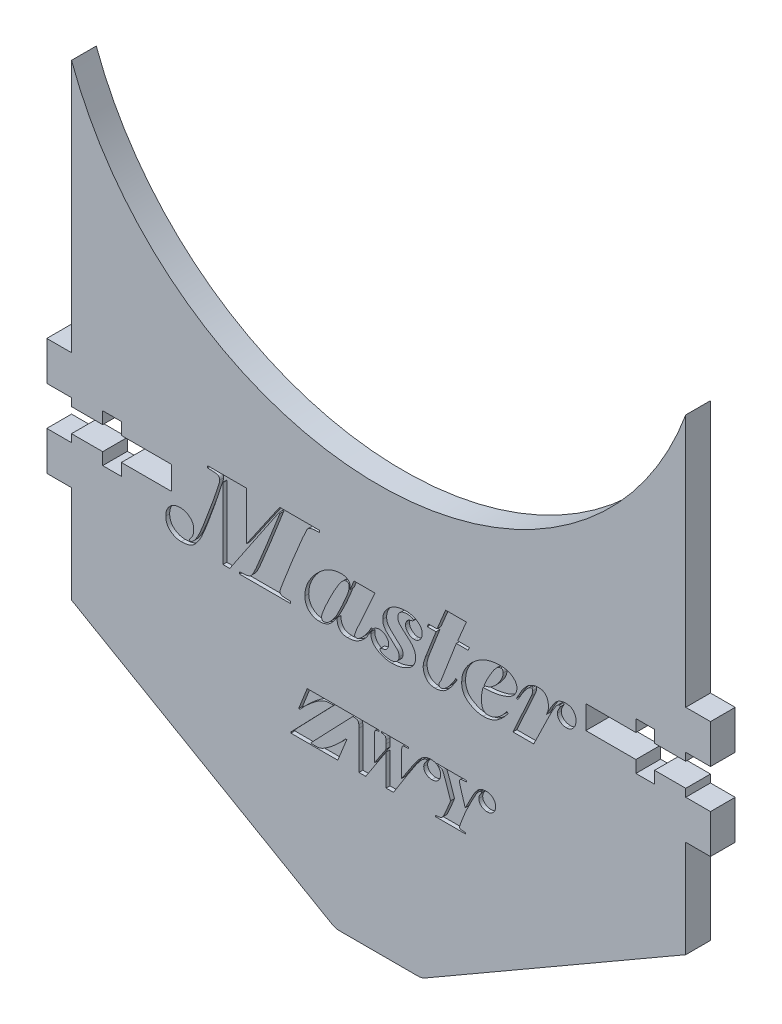
from build123d import *

# Parameters (mm, degrees)
BOSS_EXTRUDE1_DEPTH = 3.175
SKETCH2_W           = 3.175
SKETCH2_H           = 5
BOSS_EXTRUDE2_DEPTH = 3.175
CUT_EXTRUDE1_DEPTH  = 59.51485901
CUT_EXTRUDE2_DEPTH  = 0.5


with BuildPart() as part:
    # Sketch1 → Boss-Extrude1 (new body)
    with BuildSketch(Plane.XY):
        with BuildLine():
            Line((39.415, -20), (39.415, 40))
            ThreePointArc((39.415, 40), (0, 12.507162886), (-39.415, 40))
            Line((-39.415, 40), (-39.415, -20))
            Line((-39.415, -20), (-6, -39.292159245))
            ThreePointArc((-6, -39.292159245), (-5.51763809, -39.49196009), (-5, -39.560108437))
            Line((-5, -39.560108437), (5, -39.560108437))
            ThreePointArc((5, -39.560108437), (5.51763809, -39.49196009), (6, -39.292159245))
            Line((6, -39.292159245), (39.415, -20))
        make_face()
    extrude(amount=BOSS_EXTRUDE1_DEPTH)

    # Sketch2 → Boss-Extrude2 (add)
    with BuildSketch(Plane.XY.offset(3.175)):
        with Locations((41.0025, -5)):
            Rectangle(SKETCH2_W, SKETCH2_H)
        with Locations((41.0025, 5)):
            Rectangle(SKETCH2_W, SKETCH2_H)
        with Locations((-41.0025, 5)):
            Rectangle(SKETCH2_W, SKETCH2_H)
        with Locations((-41.0025, -5)):
            Rectangle(SKETCH2_W, SKETCH2_H)
    extrude(amount=-BOSS_EXTRUDE2_DEPTH)

    # Sketch3 → Cut-Extrude1 (cut, through all)
    with BuildSketch(Plane.XY.offset(3.175)):
        Polygon((39.415, 1.5), (35.415, 1.5), (35.415, 3.05), (33.015, 3.05), (33.015, 1.5), (26.59, 1.5), (26.59, -1.5), (33.015, -1.5), (33.015, -3.05), (35.415, -3.05), (35.415, -1.5), (39.415, -1.5), align=None)
        Polygon((-39.415, -1.5), (-35.415, -1.5), (-35.415, -3.05), (-33.015, -3.05), (-33.015, -1.5), (-26.59, -1.5), (-26.59, 1.5), (-33.015, 1.5), (-33.015, 3.05), (-35.415, 3.05), (-35.415, 1.5), (-39.415, 1.5), align=None)
    extrude(amount=-CUT_EXTRUDE1_DEPTH, mode=Mode.SUBTRACT)

    # Sketch4 → Cut-Extrude2 (cut)
    # profile 1 of 9: a face of its own
    with BuildSketch(Plane.XY.offset(3.175)):
        with BuildLine():
            add(Edge.make_bspline(
                [(-22.083054723, -3.089165405), (-22.117141833, -3.178244797), (-22.183169421, -3.35079382), (-22.28218976, -3.599967197), (-22.376683818, -3.831584406), (-22.46876402, -4.04511084), (-22.552156901, -4.242598925), (-22.634229557, -4.421527445), (-22.7105868, -4.582470158), (-22.807148017, -4.777327178), (-22.939887474, -5.011501886), (-23.125062253, -5.29156722), (-23.342332173, -5.577032049), (-23.540803582, -5.820170358), (-23.726332408, -6.004899245), (-23.890683112, -6.127342364), (-24.078271275, -6.227023973), (-24.285775958, -6.310514245), (-24.514373621, -6.375844997), (-24.764308042, -6.419704029), (-25.035333741, -6.448061897), (-25.223140992, -6.451629853), (-25.320792065, -6.453485025)],
                knots=[0, 0, 0, 0, 1.130253329, 2.189329135, 3.17735093, 4.09447093, 4.944908437, 5.717576898, 6.426986212, 7.055897021, 8.294352839, 9.613983634, 11.031209606, 12.54471876, 13.329263969, 14.127728774, 14.963250249, 15.839528184, 16.774249319, 17.774916539, 18.843059645, 20, 20, 20, 20], degree=3))
            add(Edge.make_bspline(
                [(-25.320792065, -6.453485025), (-25.388770052, -6.452021159), (-25.522514766, -6.449141046), (-25.719049601, -6.42473497), (-25.907748059, -6.38547897), (-26.089077295, -6.329581893), (-26.262394982, -6.258579351), (-26.429171416, -6.172846007), (-26.586943555, -6.069424139), (-26.736916743, -5.952042506), (-26.872056518, -5.820102517), (-26.992689943, -5.678720554), (-27.094789944, -5.525864124), (-27.174357461, -5.360381648), (-27.241488452, -5.187784455), (-27.286884916, -5.003731529), (-27.311949438, -4.809273663), (-27.316232115, -4.676129724), (-27.318418647, -4.608152747)],
                knots=[0, 0, 0, 0, 1.071060617, 2.107280627, 3.116046219, 4.105358694, 5.093306033, 6.064610982, 7.056049313, 8.062189232, 9.061545745, 10.02744445, 10.987119263, 11.94904156, 12.915889936, 13.901265703, 14.928485854, 16, 16, 16, 16], degree=3))
            add(Edge.make_bspline(
                [(-27.318418647, -4.608152747), (-27.317224387, -4.542115243), (-27.31488592, -4.412808045), (-27.286948526, -4.223875436), (-27.24890216, -4.042550822), (-27.19109857, -3.869396478), (-27.115354004, -3.705820493), (-27.026041784, -3.549273759), (-26.91883437, -3.403034678), (-26.796164364, -3.267380684), (-26.662566078, -3.142572645), (-26.517597, -3.033946668), (-26.365163275, -2.940081369), (-26.203930141, -2.864495509), (-26.033944617, -2.806883401), (-25.855681001, -2.765981411), (-25.669058022, -2.738923933), (-25.541748206, -2.736408886), (-25.477042065, -2.735130595)],
                knots=[0, 0, 0, 0, 1.077914775, 2.110651251, 3.114162268, 4.10188549, 5.085076634, 6.054963139, 7.041628779, 8.040737395, 9.03914912, 10.023578354, 10.995197602, 11.958844516, 12.926156071, 13.921542299, 14.943608732, 16, 16, 16, 16], degree=3))
            add(Edge.make_bspline(
                [(-25.477042065, -2.735130595), (-25.419595275, -2.735851224), (-25.306242288, -2.737273155), (-25.139175314, -2.761232445), (-24.976758059, -2.793590043), (-24.819881993, -2.841522943), (-24.668817679, -2.902867834), (-24.52448494, -2.978781465), (-24.384130354, -3.066274253), (-24.251898015, -3.16783735), (-24.129506149, -3.279763527), (-24.02151869, -3.400237419), (-23.932538536, -3.530873082), (-23.855611987, -3.66746259), (-23.798665226, -3.81416201), (-23.759722119, -3.96909225), (-23.732393566, -4.130530634), (-23.729891022, -4.241475269), (-23.728624343, -4.297630595)],
                knots=[0, 0, 0, 0, 1.054047744, 2.079828284, 3.093821156, 4.093544032, 5.087383538, 6.083874859, 7.084989954, 8.121505244, 9.14126522, 10.12770117, 11.084945916, 12.038738356, 13.001100257, 13.964375792, 14.969655976, 16, 16, 16, 16], degree=3))
            add(Edge.make_bspline(
                [(-23.728624343, -4.297630595), (-23.730475295, -4.386115783), (-23.733918848, -4.550735729), (-23.769675123, -4.781334114), (-23.828669673, -4.982089528), (-23.905753597, -5.163225925), (-24.008485183, -5.329324338), (-24.114386666, -5.449437919), (-24.200639521, -5.5363159), (-24.242459591, -5.600250382), (-24.275716149, -5.656002598), (-24.278961907, -5.694303346), (-24.280443964, -5.711791987)],
                knots=[0, 0, 0, 0, 1.698291013, 3.159540941, 4.465663762, 5.707551953, 6.930186915, 8.196362992, 8.778912473, 9.270581738, 9.66693773, 10, 10, 10, 10], degree=3))
            add(Edge.make_bspline(
                [(-24.280443964, -5.711791987), (-24.279382151, -5.728100747), (-24.277412245, -5.758357253), (-24.249954883, -5.796357905), (-24.206688915, -5.819522821), (-24.172657702, -5.820199752), (-24.153861685, -5.820573633)],
                knots=[0, 0, 0, 0, 1.012471401, 1.878367653, 2.828186478, 4, 4, 4, 4], degree=3))
            add(Edge.make_bspline(
                [(-24.153861685, -5.820573633), (-24.13590597, -5.817916341), (-24.094757231, -5.811826681), (-24.028730968, -5.784261091), (-23.954595186, -5.736449486), (-23.866146669, -5.675562966), (-23.768947537, -5.5918678), (-23.667195535, -5.481934516), (-23.558114294, -5.348111423), (-23.442272679, -5.190586138), (-23.321649636, -5.009109242), (-23.201497023, -4.802749151), (-23.081089962, -4.572941365), (-22.980933688, -4.362159443), (-22.895231235, -4.16872856), (-22.818280808, -3.992506423), (-22.733774647, -3.78536157), (-22.637299579, -3.550481794), (-22.526687638, -3.287383655), (-22.412326941, -2.992530053), (-22.282379382, -2.670297198), (-21.999877557, -1.949616777), (-21.571214589, -0.825251734), (-21.172921575, 0.315202588), (-20.923482076, 1.06588977), (-20.810982251, 1.394731666), (-20.717599163, 1.682912946), (-20.63567077, 1.92767722), (-20.570339464, 2.130927644), (-20.518629218, 2.291515253), (-20.483121489, 2.411066457), (-20.45358554, 2.511340462), (-20.434526493, 2.604205636), (-20.415460655, 2.696867044), (-20.40519758, 2.776908883), (-20.402924723, 2.825898939), (-20.401883837, 2.848334595)],
                knots=[0, 0, 0, 0, 0.192575675, 0.441321659, 0.752836899, 1.130313472, 1.582922549, 2.113752192, 2.72167908, 3.418812986, 4.192969055, 5.038546036, 5.957702433, 6.952117726, 7.520359453, 8.208260331, 8.997517169, 9.900068989, 10.909432829, 12.033339314, 13.264029703, 14.605439118, 20.267570344, 26.063238804, 27.453779967, 28.682430436, 29.760273926, 30.676214043, 31.428066217, 32.031363842, 32.470683115, 32.754868888, 33.142819525, 33.478428447, 33.761139272, 34, 34, 34, 34], degree=3))
            add(Edge.make_bspline(
                [(-20.401883837, 2.848334595), (-20.405134454, 2.90301829), (-20.411221831, 3.005423553), (-20.471330842, 3.145102924), (-20.574364559, 3.251931139), (-20.692005688, 3.30709937), (-20.804961003, 3.339816824), (-20.912445508, 3.36019694), (-21.03947106, 3.381199987), (-21.187015123, 3.392848375), (-21.354431899, 3.40504182), (-21.540999912, 3.415676886), (-21.748134837, 3.418175115), (-21.892524023, 3.419327569), (-21.968339533, 3.419932696)],
                knots=[0, 0, 0, 0, 1.052042775, 1.970143324, 2.870854876, 3.8561861, 4.440491552, 5.142328593, 5.967286194, 6.926595273, 7.999097623, 9.210638798, 10.535369249, 12, 12, 12, 12], degree=3))
            Line((-21.968339533, 3.419932696), (-21.968339533, 3.673097253))
            Line((-21.968339533, 3.673097253), (-16.938671812, 3.673097253))
            Line((-16.938671812, 3.673097253), (-16.938671812, -2.491855278))
            Line((-16.938671812, -2.491855278), (-12.700143331, 3.673097253))
            Line((-12.700143331, 3.673097253), (-7.601250926, 3.673097253))
            Line((-7.601250926, 3.673097253), (-7.601250926, 3.419932696))
            Line((-7.601250926, 3.419932696), (-8.313276242, 3.378397886))
            add(Edge.make_bspline(
                [(-8.313276242, 3.378397886), (-8.365435493, 3.373114786), (-8.465590487, 3.362970299), (-8.608779557, 3.337971268), (-8.737576529, 3.301987095), (-8.853745176, 3.259468142), (-8.954852452, 3.205385019), (-9.043838473, 3.144942318), (-9.115560036, 3.071688534), (-9.179992002, 2.986243364), (-9.239961179, 2.872904906), (-9.316269069, 2.726806654), (-9.403403277, 2.535303906), (-9.511069216, 2.303584559), (-9.630094644, 2.027333806), (-9.770204677, 1.711514571), (-9.92140916, 1.350775549), (-10.085228796, 0.957704257), (-10.253551722, 0.550736691), (-10.419362673, 0.150689316), (-10.577567948, -0.233954377), (-10.730273448, -0.602323276), (-10.876582976, -0.955448837), (-11.014623084, -1.293171163), (-11.145616359, -1.614983878), (-11.309598821, -2.017346235), (-11.500912987, -2.497126352), (-11.722170563, -3.046431921), (-11.923048385, -3.566565245), (-12.079596099, -3.97834864), (-12.195405389, -4.285002441), (-12.272269242, -4.490798371), (-12.342171387, -4.675568963), (-12.39986312, -4.840815618), (-12.455835059, -4.983125039), (-12.497000215, -5.107731261), (-12.535885846, -5.209645009), (-12.571278446, -5.314568033), (-12.604778207, -5.419284201), (-12.635121139, -5.523238719), (-12.654950533, -5.601652335), (-12.658980366, -5.646464649), (-12.660586369, -5.664323633)],
                knots=[0, 0, 0, 0, 0.609719282, 1.170768945, 1.687971488, 2.163657319, 2.606169063, 3.018909416, 3.409318741, 3.79273691, 4.259752201, 4.897656796, 5.710684151, 6.705800193, 7.869826431, 9.209048519, 10.724457597, 12.419165901, 14.162247475, 15.846932979, 17.45612035, 18.99982494, 20.485133676, 21.902038904, 23.243454641, 24.526479772, 26.955790176, 29.251245295, 31.414389885, 33.441000648, 34.375314494, 35.227055323, 35.996226954, 36.673000752, 37.26266748, 37.774383521, 38.198922844, 38.531149764, 39.062263512, 39.477277151, 39.791680049, 40, 40, 40, 40], degree=3))
            add(Edge.make_bspline(
                [(-12.660586369, -5.664323633), (-12.657222325, -5.70666254), (-12.650882011, -5.78645996), (-12.589592536, -5.89359474), (-12.487737326, -5.968196491), (-12.34671178, -6.014627178), (-12.162307681, -6.040278661), (-11.926434987, -6.058244339), (-11.6349091, -6.072814016), (-11.421816409, -6.073412331), (-11.305760419, -6.07373819)],
                knots=[0, 0, 0, 0, 0.649345372, 1.22384086, 1.840780064, 2.555677005, 3.494523509, 4.710168862, 6.208269811, 8, 8, 8, 8], degree=3))
            Line((-11.305760419, -6.07373819), (-11.305760419, -6.326902747))
            Line((-11.305760419, -6.326902747), (-17.824747761, -6.326902747))
            Line((-17.824747761, -6.326902747), (-17.824747761, -6.07373819))
            Line((-17.824747761, -6.07373819), (-17.073165483, -6.018358443))
            add(Edge.make_bspline(
                [(-17.073165483, -6.018358443), (-16.994222334, -6.007642286), (-16.84431899, -5.987293619), (-16.638397026, -5.920282806), (-16.465676124, -5.826057535), (-16.344205467, -5.723482824), (-16.264213215, -5.618292584), (-16.195815181, -5.522715868), (-16.123589542, -5.406232829), (-16.047148851, -5.269924986), (-15.965494962, -5.114206557), (-15.879335212, -4.939341608), (-15.787814671, -4.744096401), (-15.65582942, -4.448764991), (-15.479068347, -4.043217744), (-15.257788709, -3.515105111), (-15.018521717, -2.936492506), (-14.764286786, -2.307415851), (-14.497065389, -1.632000759), (-14.212081732, -0.917930798), (-13.914880901, -0.164972224), (-13.662948361, 0.480549148), (-13.458413843, 0.995929992), (-13.317647703, 1.362334517), (-13.182231164, 1.699663018), (-13.059162818, 2.010674061), (-12.949278276, 2.295425181), (-12.847784011, 2.552960663), (-12.757398249, 2.783945049), (-12.699557544, 2.928796148), (-12.672453457, 2.996673203)],
                knots=[0, 0, 0, 0, 0.65053556, 1.235287143, 1.758915764, 2.251867672, 2.520449317, 2.83756191, 3.213006897, 3.640298547, 4.115356038, 4.650595122, 5.234227324, 5.878500359, 7.295707455, 8.85166571, 10.56064525, 12.41569243, 14.399872011, 16.500178696, 18.702616275, 21.019204905, 22.166478535, 23.236698744, 24.228788535, 25.138795108, 25.971746855, 26.724588927, 27.402343865, 28, 28, 28, 28], degree=3))
            Line((-12.672453457, 2.996673203), (-12.781235103, 3.05205295))
            Line((-12.781235103, 3.05205295), (-19.106393331, -6.326902747))
            Line((-19.106393331, -6.326902747), (-19.976646495, -6.326902747))
            Line((-19.976646495, -6.326902747), (-19.976646495, 2.78108776))
            Line((-19.976646495, 2.78108776), (-20.030048394, 2.78108776))
            add(Edge.make_bspline(
                [(-20.030048394, 2.78108776), (-20.105264224, 2.552335546), (-20.251137438, 2.108694622), (-20.462034675, 1.464117477), (-20.661689325, 0.862149594), (-20.822199409, 0.388890597), (-20.939226726, 0.033421175), (-21.023856381, -0.210423264), (-21.099650952, -0.43921213), (-21.172697545, -0.650904488), (-21.243128408, -0.84539283), (-21.305606429, -1.024345947), (-21.362953035, -1.187430286), (-21.418587456, -1.339640213), (-21.476377117, -1.493752829), (-21.539397882, -1.66197212), (-21.611887874, -1.849796307), (-21.68636217, -2.059883268), (-21.778262394, -2.286795877), (-21.872000173, -2.536719351), (-21.97441219, -2.806531426), (-22.046065082, -2.992936707), (-22.083054723, -3.089165405)],
                knots=[0, 0, 0, 0, 2.322821778, 4.504869202, 6.542096527, 8.440562444, 9.325438639, 10.152015468, 10.930306902, 11.650319291, 12.3121151, 12.925577606, 13.478716634, 13.979673956, 14.488799598, 15.066403991, 15.712490578, 16.430787678, 17.216140408, 18.073625888, 19.005540664, 20, 20, 20, 20], degree=3))
        make_face()
    # profile 2 of 9: a face of its own
    with BuildSketch(Plane.XY.offset(3.175)):
        with BuildLine():
            Line((-0.475064217, 0.255375734), (-2.840570546, -5.005700215))
            add(Edge.make_bspline(
                [(-2.840570546, -5.005700215), (-2.848564498, -5.023464487), (-2.867963524, -5.066573274), (-2.899756336, -5.144105991), (-2.936545503, -5.246641135), (-2.976653194, -5.364899578), (-3.01695491, -5.481660188), (-3.045631407, -5.581468918), (-3.066142752, -5.655016899), (-3.070346031, -5.695908033), (-3.071978774, -5.711791987)],
                knots=[0, 0, 0, 0, 0.627694273, 1.523233798, 2.699366387, 4.13708463, 5.547868024, 6.677214297, 7.486170567, 8, 8, 8, 8], degree=3))
            add(Edge.make_bspline(
                [(-3.071978774, -5.711791987), (-3.070142219, -5.745088142), (-3.066772211, -5.806185308), (-3.031860714, -5.887550648), (-2.964590155, -5.940016617), (-2.910704659, -5.94468056), (-2.882105356, -5.947155911)],
                knots=[0, 0, 0, 0, 1.164608766, 2.137012372, 3.011233996, 4, 4, 4, 4], degree=3))
            add(Edge.make_bspline(
                [(-2.882105356, -5.947155911), (-2.846812285, -5.942656263), (-2.767021673, -5.932483454), (-2.641272407, -5.878133065), (-2.499234938, -5.790391115), (-2.338615672, -5.672500451), (-2.16664509, -5.522474828), (-1.986027952, -5.343693648), (-1.801844952, -5.135301334), (-1.610889327, -4.904307214), (-1.422743455, -4.650836253), (-1.241498434, -4.381149776), (-1.070134414, -4.09647122), (-0.965335494, -3.899261696), (-0.912168647, -3.799212873)],
                knots=[0, 0, 0, 0, 0.427370454, 0.966199587, 1.632892567, 2.440647411, 3.365013317, 4.382493076, 5.502849294, 6.717190868, 7.995525754, 9.30743356, 10.634000544, 12, 12, 12, 12], degree=3))
            Line((-0.912168647, -3.799212873), (-0.734162318, -3.882282493))
            add(Edge.make_bspline(
                [(-0.734162318, -3.882282493), (-0.798143048, -3.99801109), (-0.923067084, -4.223974178), (-1.117880302, -4.551194431), (-1.317122683, -4.857045445), (-1.516134022, -5.148087605), (-1.730566312, -5.417395629), (-1.971382466, -5.660903061), (-2.236126614, -5.883405369), (-2.523591328, -6.084941587), (-2.841345358, -6.252283657), (-3.192822672, -6.36789379), (-3.573295719, -6.44112409), (-3.837713809, -6.44928336), (-3.973877508, -6.453485025)],
                knots=[0, 0, 0, 0, 1.086196811, 2.120827455, 3.127251978, 4.084219244, 5.01625255, 5.950642852, 6.892271206, 7.853687195, 8.829815884, 9.82994092, 10.88251492, 12, 12, 12, 12], degree=3))
            add(Edge.make_bspline(
                [(-3.973877508, -6.453485025), (-4.029316619, -6.452460038), (-4.13654344, -6.450477573), (-4.291953117, -6.431990552), (-4.436931644, -6.403856516), (-4.570083423, -6.358935958), (-4.693795979, -6.3059056), (-4.807975245, -6.241163658), (-4.908359062, -6.160324546), (-5.001565229, -6.071530038), (-5.080275649, -5.967011177), (-5.149139637, -5.852028629), (-5.210023646, -5.726196193), (-5.256041541, -5.586891201), (-5.294344706, -5.436351444), (-5.318846265, -5.273347876), (-5.335081276, -5.09898679), (-5.337398155, -4.978709805), (-5.338592698, -4.91669705)],
                knots=[0, 0, 0, 0, 1.129023657, 2.183686145, 3.184722607, 4.13195423, 5.04029239, 5.924983641, 6.795592937, 7.659962715, 8.541180169, 9.451105987, 10.388380583, 11.382362946, 12.434627692, 13.549823423, 14.736730888, 16, 16, 16, 16], degree=3))
            add(Edge.make_bspline(
                [(-5.338592698, -4.91669705), (-5.424453047, -5.04393853), (-5.586938918, -5.284735854), (-5.845648085, -5.606736211), (-6.095207902, -5.875865167), (-6.344766609, -6.094684167), (-6.612969116, -6.26030735), (-6.912350632, -6.372511461), (-7.245221374, -6.443411771), (-7.479559494, -6.450041972), (-7.601250926, -6.453485025)],
                knots=[0, 0, 0, 0, 1.278828497, 2.420110821, 3.438518213, 4.334855876, 5.1782484, 6.049668921, 6.987196012, 8, 8, 8, 8], degree=3))
            add(Edge.make_bspline(
                [(-7.601250926, -6.453485025), (-7.667945456, -6.45226077), (-7.799215213, -6.449851162), (-7.990775056, -6.422110631), (-8.174272184, -6.384466707), (-8.347297835, -6.325481832), (-8.512628074, -6.253285015), (-8.666546648, -6.160990715), (-8.813047259, -6.055461071), (-8.948554101, -5.933666402), (-9.070607622, -5.797313136), (-9.177929836, -5.651222507), (-9.267713904, -5.494216523), (-9.343340048, -5.328514943), (-9.401066994, -5.15133518), (-9.438800808, -4.964690853), (-9.466878121, -4.769196208), (-9.469151475, -4.635291795), (-9.470317381, -4.566617937)],
                knots=[0, 0, 0, 0, 1.072128102, 2.110187965, 3.108807038, 4.081516143, 5.045394929, 6.005882854, 6.962732776, 7.946654207, 8.930575638, 9.902243236, 10.857386755, 11.835286754, 12.828143538, 13.847502029, 14.896075661, 16, 16, 16, 16], degree=3))
            add(Edge.make_bspline(
                [(-9.470317381, -4.566617937), (-9.465367121, -4.432522021), (-9.455406394, -4.162699296), (-9.385781517, -3.758473367), (-9.270352039, -3.3546534), (-9.105483912, -2.952529585), (-8.899176012, -2.5486786), (-8.643668504, -2.147060655), (-8.343627927, -1.744969743), (-8.004495085, -1.350684762), (-7.64102089, -0.976804368), (-7.255856082, -0.649910804), (-6.863038655, -0.370160225), (-6.460090597, -0.140706328), (-6.045743384, 0.037843489), (-5.620466661, 0.161626127), (-5.185915079, 0.240449434), (-4.892590416, 0.250384724), (-4.745238267, 0.255375734)],
                knots=[0, 0, 0, 0, 0.874605031, 1.759847143, 2.667865008, 3.609485207, 4.590475037, 5.622626212, 6.710760195, 7.860675678, 9.013322554, 10.108665916, 11.151612089, 12.155057116, 13.128095146, 14.087540987, 15.039272926, 16, 16, 16, 16], degree=3))
            add(Edge.make_bspline(
                [(-4.745238267, 0.255375734), (-4.676478669, 0.252658583), (-4.541093669, 0.247308618), (-4.343957393, 0.206700799), (-4.157233954, 0.140798924), (-3.984548416, 0.049792684), (-3.832960913, -0.068084904), (-3.72291967, -0.224442446), (-3.658963011, -0.411729918), (-3.651455139, -0.546462698), (-3.647532571, -0.616855278)],
                knots=[0, 0, 0, 0, 1.047369411, 2.062230016, 3.053792087, 4.056240477, 5.027640052, 5.950427798, 6.929179114, 8, 8, 8, 8], degree=3))
            Line((-3.647532571, -0.616855278), (-3.647532571, -0.955067304))
            Line((-3.647532571, -0.955067304), (-3.168893331, 0.255375734))
            Line((-3.168893331, 0.255375734), (-0.475064217, 0.255375734))
        make_face()
        with BuildLine():
            add(Edge.make_bspline(
                [(-3.77411485, -0.672235025), (-3.774999999, -0.638479193), (-3.776663274, -0.575048992), (-3.795356698, -0.487460651), (-3.820779924, -0.411440545), (-3.865067381, -0.352955141), (-3.917433355, -0.304413929), (-3.985943569, -0.273490809), (-4.06629651, -0.253093485), (-4.124699277, -0.251697641), (-4.155839533, -0.25095338)],
                knots=[0, 0, 0, 0, 1.234466941, 2.319672873, 3.275581501, 4.140755029, 4.979544043, 5.865720795, 6.862005977, 8, 8, 8, 8], degree=3))
            add(Edge.make_bspline(
                [(-4.155839533, -0.25095338), (-4.202710505, -0.25697799), (-4.304637599, -0.270079299), (-4.457008781, -0.351872618), (-4.61312522, -0.48239344), (-4.748951688, -0.623152745), (-4.862274434, -0.763880748), (-4.959834604, -0.890255213), (-5.062217183, -1.037113564), (-5.170476335, -1.203017043), (-5.284754309, -1.387672472), (-5.408220199, -1.589200008), (-5.535855114, -1.810649087), (-5.717638258, -2.133690239), (-5.947005245, -2.563000571), (-6.222057403, -3.10200603), (-6.498819996, -3.666548956), (-6.723584621, -4.149549315), (-6.893523587, -4.53160102), (-7.007144881, -4.793131973), (-7.100054885, -5.029811188), (-7.17755224, -5.239372245), (-7.239730421, -5.422371235), (-7.28347538, -5.578696099), (-7.312568074, -5.708087907), (-7.316630028, -5.786184845), (-7.318418647, -5.820573633)],
                knots=[0, 0, 0, 0, 0.516099531, 1.122326332, 1.864976407, 2.751864272, 3.266995654, 3.851286055, 4.506901189, 5.234721424, 6.029229026, 6.894494295, 7.833192313, 8.83932863, 10.970087064, 13.184327498, 15.49257689, 17.882759239, 19.041246512, 20.090160594, 21.017623734, 21.836364841, 22.546979255, 23.141433541, 23.621943447, 24, 24, 24, 24], degree=3))
            add(Edge.make_bspline(
                [(-7.318418647, -5.820573633), (-7.316178248, -5.874380029), (-7.312133521, -5.971519914), (-7.271902937, -6.082730397), (-7.222452829, -6.146429473), (-7.176091379, -6.176444183), (-7.123787537, -6.198039288), (-7.085272705, -6.199540298), (-7.06525409, -6.200320468)],
                knots=[0, 0, 0, 0, 1.878293612, 3.390995041, 4.046953324, 4.661413382, 5.304251175, 6, 6, 6, 6], degree=3))
            add(Edge.make_bspline(
                [(-7.06525409, -6.200320468), (-6.992718319, -6.195272533), (-6.845549189, -6.185030687), (-6.63044009, -6.101763979), (-6.424935135, -5.967561011), (-6.234606873, -5.788588877), (-6.060620803, -5.593587168), (-5.896235724, -5.411295649), (-5.759487922, -5.240467216), (-5.631883637, -5.07903144), (-5.513820184, -4.894507051), (-5.384227686, -4.671315622), (-5.23807307, -4.397395127), (-5.076523382, -4.07228169), (-4.897824048, -3.696196711), (-4.696655111, -3.272493953), (-4.485491315, -2.795776683), (-4.295514557, -2.375988851), (-4.147454758, -2.02966834), (-4.048522166, -1.781930217), (-3.965820154, -1.552033251), (-3.894783595, -1.341699932), (-3.841608229, -1.148813042), (-3.803039292, -0.973995884), (-3.780017626, -0.817227695), (-3.775996151, -0.718446305), (-3.77411485, -0.672235025)],
                knots=[0, 0, 0, 0, 0.778653043, 1.579823155, 2.447561567, 3.406631853, 4.380513405, 5.260001116, 6.04656208, 6.734652123, 7.472427149, 8.400678846, 9.511414454, 10.812031125, 12.306369687, 13.991331621, 15.858159363, 17.915825647, 18.948752577, 19.910311611, 20.785411821, 21.577232628, 22.298279798, 22.936876941, 23.502656554, 24, 24, 24, 24], degree=3))
        make_face(mode=Mode.SUBTRACT)
    # profile 3 of 9: a face of its own
    with BuildSketch(Plane.XY.offset(3.175)):
        with BuildLine():
            add(Edge.make_bspline(
                [(3.536011733, 0.255375734), (3.605942899, 0.254412731), (3.743461879, 0.252518994), (3.945117651, 0.232397479), (4.138861139, 0.198780546), (4.324389982, 0.150950196), (4.503388425, 0.092135608), (4.674065135, 0.01855563), (4.836980482, -0.06860971), (4.989101638, -0.168845584), (5.130113146, -0.276361431), (5.252873404, -0.39357514), (5.35871823, -0.516027065), (5.445492318, -0.645812984), (5.51045773, -0.783547085), (5.558889549, -0.926686), (5.58704318, -1.077258011), (5.590972778, -1.179767477), (5.592973758, -1.231966038)],
                knots=[0, 0, 0, 0, 1.193583483, 2.347170679, 3.455615708, 4.547594062, 5.615404902, 6.669182667, 7.716629568, 8.765587284, 9.776473278, 10.739807269, 11.657890029, 12.535113947, 13.396010568, 14.25025924, 15.109019364, 16, 16, 16, 16], degree=3))
            add(Edge.make_bspline(
                [(5.592973758, -1.231966038), (5.589953651, -1.308162291), (5.58406309, -1.456779138), (5.526013902, -1.670779675), (5.432783596, -1.867528941), (5.301664729, -2.040215544), (5.145201583, -2.186194502), (4.962369139, -2.290665311), (4.760299363, -2.357936849), (4.617779538, -2.364094183), (4.544714264, -2.367250848)],
                knots=[0, 0, 0, 0, 1.059041069, 2.065604798, 3.06346372, 4.073371523, 5.067676323, 6.021968427, 6.985927611, 8, 8, 8, 8], degree=3))
            add(Edge.make_bspline(
                [(4.544714264, -2.367250848), (4.478984445, -2.363462021), (4.34681498, -2.355843452), (4.154292117, -2.292524367), (3.969080678, -2.193389918), (3.797284765, -2.059067034), (3.646981305, -1.898918837), (3.538574786, -1.715065602), (3.468527921, -1.516426138), (3.460813241, -1.377588526), (3.456897808, -1.307124266)],
                knots=[0, 0, 0, 0, 0.941754687, 1.893679551, 2.880215978, 3.946056272, 5.011181956, 6.01267768, 6.991374199, 8, 8, 8, 8], degree=3))
            add(Edge.make_bspline(
                [(3.456897808, -1.307124266), (3.45836701, -1.267438209), (3.461283306, -1.188663244), (3.486024128, -1.074366018), (3.523387376, -0.965431688), (3.577063965, -0.86577765), (3.639707733, -0.776806144), (3.704915533, -0.698380916), (3.77382357, -0.633685688), (3.877454056, -0.568359111), (4.027593201, -0.505461978), (4.189976043, -0.469883569), (4.319942958, -0.443211775), (4.392636768, -0.405653589), (4.445514221, -0.358671773), (4.451084312, -0.317839923), (4.453733252, -0.298421734)],
                knots=[0, 0, 0, 0, 1.069927318, 2.12375562, 3.142296082, 4.169040102, 5.166062442, 6.075054983, 6.918845797, 7.70353896, 9.369312755, 11.276695608, 12.195904787, 12.92017616, 13.486473847, 14, 14, 14, 14], degree=3))
            add(Edge.make_bspline(
                [(4.453733252, -0.298421734), (4.450545628, -0.280017805), (4.44360928, -0.239970408), (4.397476038, -0.186606401), (4.32783337, -0.139002699), (4.235720513, -0.089231748), (4.118777835, -0.049639698), (3.981224757, -0.017288479), (3.822525138, -0.000973086), (3.710090514, 0.001110879), (3.650726922, 0.002211177)],
                knots=[0, 0, 0, 0, 0.484938189, 1.055237337, 1.788954279, 2.714497086, 3.803302777, 5.034758036, 6.434402073, 8, 8, 8, 8], degree=3))
            add(Edge.make_bspline(
                [(3.650726922, 0.002211177), (3.568061255, -0.000460025), (3.408370528, -0.005620162), (3.180040431, -0.055559723), (2.9748379, -0.139831348), (2.795056051, -0.253291709), (2.646416047, -0.39337831), (2.539000926, -0.55726138), (2.471597245, -0.741747185), (2.463985554, -0.872072653), (2.460062365, -0.939244519)],
                knots=[0, 0, 0, 0, 1.169721373, 2.259627993, 3.28976359, 4.297517612, 5.255220354, 6.159191544, 7.051217378, 8, 8, 8, 8], degree=3))
            add(Edge.make_bspline(
                [(2.460062365, -0.939244519), (2.461620835, -0.990082633), (2.464591586, -1.08699013), (2.485723311, -1.224876514), (2.522870072, -1.346275302), (2.576674484, -1.455556406), (2.654510585, -1.557184817), (2.746191557, -1.670482378), (2.864497335, -1.792114713), (2.951620564, -1.875716699), (2.998037049, -1.920257177)],
                knots=[0, 0, 0, 0, 1.049619653, 2.000782574, 2.870528743, 3.661962143, 4.500686251, 5.506396301, 6.671487278, 8, 8, 8, 8], degree=3))
            Line((2.998037049, -1.920257177), (4.050252239, -2.861712873))
            add(Edge.make_bspline(
                [(4.050252239, -2.861712873), (4.106729848, -2.916720849), (4.216578191, -3.023710772), (4.358248159, -3.196369219), (4.47843203, -3.369474117), (4.577565895, -3.545565971), (4.654132645, -3.729939637), (4.706965004, -3.926750033), (4.742163492, -4.136160156), (4.745003823, -4.280999035), (4.746454771, -4.35498819)],
                knots=[0, 0, 0, 0, 1.112310766, 2.163432489, 3.147112795, 4.084616207, 5.011104275, 5.957254389, 6.956488608, 8, 8, 8, 8], degree=3))
            add(Edge.make_bspline(
                [(4.746454771, -4.35498819), (4.744339799, -4.435687423), (4.740195063, -4.593834687), (4.6914096, -4.82344727), (4.620377346, -5.041271419), (4.512628573, -5.242402768), (4.37920152, -5.430640755), (4.214086537, -5.60412266), (4.020079276, -5.763958426), (3.798781407, -5.906059841), (3.560940481, -6.032695886), (3.314646836, -6.145262569), (3.061856357, -6.241379211), (2.801735888, -6.317926789), (2.535669782, -6.379481546), (2.262784739, -6.423022259), (1.983932084, -6.449432364), (1.795563346, -6.452126412), (1.700568695, -6.453485025)],
                knots=[0, 0, 0, 0, 0.942462759, 1.846955687, 2.734721885, 3.614411194, 4.504686391, 5.426731912, 6.407301727, 7.438374677, 8.497702992, 9.557255884, 10.604357132, 11.658506978, 12.726781537, 13.796919746, 14.888983151, 16, 16, 16, 16], degree=3))
            add(Edge.make_bspline(
                [(1.700568695, -6.453485025), (1.615435677, -6.45227113), (1.447404344, -6.449875202), (1.198662022, -6.421536764), (0.955577711, -6.384261276), (0.719349429, -6.325406641), (0.488792843, -6.252992441), (0.266110584, -6.161181571), (0.048303782, -6.055738175), (-0.160459341, -5.935797575), (-0.352349951, -5.80068696), (-0.523432743, -5.656321538), (-0.665812414, -5.49924331), (-0.785329724, -5.333642168), (-0.87655235, -5.15612067), (-0.942650829, -4.969330851), (-0.980801847, -4.771870229), (-0.986429884, -4.637323278), (-0.989304723, -4.568595785)],
                knots=[0, 0, 0, 0, 1.125365401, 2.221190473, 3.307783493, 4.375779789, 5.437457053, 6.501280567, 7.558112832, 8.636417562, 9.681493819, 10.658475067, 11.590490858, 12.478432746, 13.352001573, 14.220682775, 15.091112708, 16, 16, 16, 16], degree=3))
            add(Edge.make_bspline(
                [(-0.989304723, -4.568595785), (-0.985767505, -4.496294247), (-0.978785201, -4.353574381), (-0.9152957, -4.149014397), (-0.81065874, -3.962609226), (-0.671644371, -3.795558716), (-0.49904516, -3.656630286), (-0.300358683, -3.553937888), (-0.077730966, -3.493178149), (0.077693805, -3.48630282), (0.157847176, -3.482757177)],
                knots=[0, 0, 0, 0, 0.983375265, 1.941136964, 2.886173187, 3.881175811, 4.884378202, 5.884881695, 6.909222379, 8, 8, 8, 8], degree=3))
            add(Edge.make_bspline(
                [(0.157847176, -3.482757177), (0.226208498, -3.486444639), (0.363730791, -3.493862698), (0.564951239, -3.55894352), (0.756834663, -3.66434653), (0.935097674, -3.804715195), (1.090219864, -3.970660475), (1.205521806, -4.157042622), (1.277868791, -4.359079638), (1.285373083, -4.499438945), (1.289176289, -4.570573633)],
                knots=[0, 0, 0, 0, 0.949095041, 1.909292016, 2.910613127, 3.982057805, 5.053070614, 6.053467261, 7.013489018, 8, 8, 8, 8], degree=3))
            add(Edge.make_bspline(
                [(1.289176289, -4.570573633), (1.287472729, -4.620847866), (1.284119468, -4.719806909), (1.251850064, -4.862941017), (1.197926241, -4.996184869), (1.122371383, -5.114443059), (1.037675096, -5.218719941), (0.944092593, -5.300984184), (0.845131494, -5.361370771), (0.707525015, -5.404636588), (0.538128348, -5.440107481), (0.376159781, -5.474926056), (0.258679982, -5.509499729), (0.195407761, -5.556881802), (0.15571045, -5.620808736), (0.151904397, -5.669043023), (0.149935783, -5.693991354)],
                knots=[0, 0, 0, 0, 1.186646832, 2.335777727, 3.44678149, 4.566490606, 5.639709129, 6.611437431, 7.498545556, 8.355875488, 10.003613063, 11.587120882, 12.281965091, 12.870925587, 13.416006231, 14, 14, 14, 14], degree=3))
            add(Edge.make_bspline(
                [(0.149935783, -5.693991354), (0.156385245, -5.721489913), (0.17162346, -5.78646106), (0.261917881, -5.868449087), (0.393190388, -5.949160862), (0.568586215, -6.033944145), (0.780149273, -6.106303496), (1.016462228, -6.162411052), (1.27321798, -6.192923493), (1.450624601, -6.197799602), (1.542340846, -6.200320468)],
                knots=[0, 0, 0, 0, 0.428826237, 1.013192478, 1.802224428, 2.832798303, 4.009729408, 5.256152229, 6.581476754, 8, 8, 8, 8], degree=3))
            add(Edge.make_bspline(
                [(1.542340846, -6.200320468), (1.613810167, -6.1974382), (1.753148011, -6.191818878), (1.955053751, -6.143088442), (2.140341274, -6.060603681), (2.308751097, -5.950605396), (2.451437837, -5.814849228), (2.554973393, -5.654165547), (2.620222034, -5.475318637), (2.62679715, -5.34908655), (2.630157302, -5.284576797)],
                knots=[0, 0, 0, 0, 1.083193287, 2.111812666, 3.128398706, 4.146508975, 5.150917522, 6.091440123, 7.024647942, 8, 8, 8, 8], degree=3))
            add(Edge.make_bspline(
                [(2.630157302, -5.284576797), (2.628589267, -5.22914272), (2.62564471, -5.125045076), (2.60542367, -4.978191848), (2.565734681, -4.852221633), (2.510143143, -4.742372432), (2.437063313, -4.644368945), (2.352857811, -4.543022522), (2.249987643, -4.440342339), (2.131521508, -4.330714066), (1.998402562, -4.212017785), (1.850007905, -4.081541654), (1.686078551, -3.938860375), (1.510634041, -3.790996077), (1.341339664, -3.638437806), (1.187264029, -3.4937292), (1.056378047, -3.358714261), (0.912422008, -3.198539888), (0.769572224, -3.002022338), (0.652248335, -2.799777917), (0.586320002, -2.627125628), (0.554598663, -2.481194892), (0.531434175, -2.318539476), (0.530284802, -2.203845069), (0.529682619, -2.143754012)],
                knots=[0, 0, 0, 0, 0.930213495, 1.746814219, 2.477957566, 3.135903828, 3.801982319, 4.524286465, 5.34559343, 6.237806415, 7.232659446, 8.337751706, 9.553151365, 10.878909574, 12.187014994, 13.376312277, 14.424525607, 15.34129112, 16.987327942, 18.492537, 19.248608602, 20.077699939, 20.992862481, 22, 22, 22, 22], degree=3))
            add(Edge.make_bspline(
                [(0.529682619, -2.143754012), (0.531582435, -2.069053689), (0.535375826, -1.919898461), (0.577908535, -1.699994325), (0.63978844, -1.484054359), (0.733424183, -1.275740267), (0.84844577, -1.07062328), (0.98956664, -0.870465327), (1.157568478, -0.676278265), (1.347477556, -0.487770145), (1.558277115, -0.312453773), (1.790902268, -0.1606368), (2.040667593, -0.032903017), (2.306142139, 0.075115868), (2.589464183, 0.155953204), (2.889457473, 0.212180327), (3.206772885, 0.249146852), (3.424485415, 0.253265764), (3.536011733, 0.255375734)],
                knots=[0, 0, 0, 0, 0.839387383, 1.676017072, 2.51156089, 3.361889621, 4.23872381, 5.154509017, 6.111945879, 7.1242728, 8.162361429, 9.191052264, 10.242727088, 11.314381308, 12.410729917, 13.551281029, 14.745609133, 16, 16, 16, 16], degree=3))
        make_face()
    # profile 4 of 9: a face of its own
    with BuildSketch(Plane.XY.offset(3.175)):
        with BuildLine():
            Line((11.668923125, 0.255375734), (11.490916796, -0.124371101))
            Line((11.490916796, -0.124371101), (9.967973758, -0.124371101))
            Line((9.967973758, -0.124371101), (7.998037049, -5.245019835))
            add(Edge.make_bspline(
                [(7.998037049, -5.245019835), (7.973396722, -5.281776575), (7.927664197, -5.349997201), (7.868658765, -5.445520796), (7.824371435, -5.526358501), (7.782423064, -5.609249639), (7.752465927, -5.706407328), (7.74738597, -5.782783818), (7.744872492, -5.820573633)],
                knots=[0, 0, 0, 0, 1.247813579, 2.315945937, 3.164640005, 3.846450139, 4.934459414, 6, 6, 6, 6], degree=3))
            add(Edge.make_bspline(
                [(7.744872492, -5.820573633), (7.747645794, -5.858261496), (7.752725507, -5.92729239), (7.806480707, -6.016625864), (7.895462837, -6.066392456), (7.962499176, -6.071193186), (7.998037049, -6.07373819)],
                knots=[0, 0, 0, 0, 1.106721864, 2.02712474, 2.954122615, 4, 4, 4, 4], degree=3))
            add(Edge.make_bspline(
                [(7.998037049, -6.07373819), (8.029226718, -6.071642103), (8.094863468, -6.067231015), (8.19629016, -6.034420674), (8.303633387, -5.982370893), (8.464543249, -5.884314333), (8.673186278, -5.718598604), (8.877920694, -5.517512927), (9.048514954, -5.330368451), (9.180426935, -5.166378393), (9.317956873, -4.988858573), (9.452243609, -4.795974316), (9.585540826, -4.600795), (9.705148311, -4.406433219), (9.815149157, -4.221452981), (9.879496384, -4.09815985), (9.910616163, -4.038532493)],
                knots=[0, 0, 0, 0, 0.455867401, 0.959345062, 1.546099652, 2.199464825, 3.711959582, 5.430806499, 6.393605441, 7.414916098, 8.508707038, 9.6781267, 10.852467916, 11.965814963, 13.016221959, 14, 14, 14, 14], degree=3))
            Line((9.910616163, -4.038532493), (10.088622492, -4.13544705))
            add(Edge.make_bspline(
                [(10.088622492, -4.13544705), (10.033775447, -4.228073483), (9.926367665, -4.409465202), (9.760139175, -4.669534626), (9.597176402, -4.913145364), (9.432859515, -5.137208893), (9.274977451, -5.347386245), (9.114079564, -5.537195067), (8.95513182, -5.709458924), (8.799895513, -5.867986176), (8.638065405, -6.006046365), (8.469338226, -6.125380091), (8.292065833, -6.227121342), (8.105574078, -6.311072007), (7.909441956, -6.373335145), (7.705713216, -6.419410885), (7.493153097, -6.447628858), (7.348070517, -6.451508287), (7.274144644, -6.453485025)],
                knots=[0, 0, 0, 0, 1.345652446, 2.635211164, 3.858205228, 5.008938728, 6.108473114, 7.143728808, 8.1178614, 9.038687254, 9.915681998, 10.773212087, 11.618655538, 12.467226855, 13.324756944, 14.186554165, 15.075970624, 16, 16, 16, 16], degree=3))
            add(Edge.make_bspline(
                [(7.274144644, -6.453485025), (7.211450862, -6.451877069), (7.089628388, -6.448752592), (6.91268897, -6.427157953), (6.747386676, -6.390041066), (6.594574158, -6.33594237), (6.452707762, -6.269637217), (6.324640011, -6.184474077), (6.207642314, -6.086280318), (6.071349054, -5.934542537), (5.929336191, -5.72297051), (5.807861519, -5.441284405), (5.731619872, -5.13628406), (5.723643602, -4.924406694), (5.719556036, -4.815826797)],
                knots=[0, 0, 0, 0, 0.885144897, 1.71995591, 2.512594366, 3.272182253, 4.005001528, 4.717616501, 5.437551085, 6.155798508, 7.591327806, 9.012935352, 10.469231633, 12, 12, 12, 12], degree=3))
            add(Edge.make_bspline(
                [(5.719556036, -4.815826797), (5.721728853, -4.719266101), (5.725825109, -4.537227121), (5.772119959, -4.314523434), (5.824199838, -4.137861123), (5.877096493, -3.985335546), (5.934991721, -3.80550433), (5.981455012, -3.679053332), (6.006344011, -3.611317304)],
                knots=[0, 0, 0, 0, 1.392765717, 2.625681673, 3.270728499, 4.053883211, 4.957523264, 6, 6, 6, 6], degree=3))
            Line((6.006344011, -3.611317304), (7.365125657, -0.124371101))
            Line((7.365125657, -0.124371101), (6.241707935, -0.124371101))
            Line((6.241707935, -0.124371101), (6.405869327, 0.255375734))
            Line((6.405869327, 0.255375734), (7.491707935, 0.255375734))
            Line((7.491707935, 0.255375734), (8.599302872, 2.893825101))
            Line((8.599302872, 2.893825101), (11.25753072, 2.893825101))
            Line((11.25753072, 2.893825101), (10.149935783, 0.255375734))
            Line((10.149935783, 0.255375734), (11.668923125, 0.255375734))
        make_face()
    # profile 5 of 9: a face of its own
    with BuildSketch(Plane.XY.offset(3.175)):
        with BuildLine():
            add(Edge.make_bspline(
                [(13.407451606, -3.288928063), (13.392941755, -3.334898691), (13.361913523, -3.43320344), (13.327113226, -3.593272877), (13.288265467, -3.771555257), (13.254606164, -3.962949342), (13.22440198, -4.155330821), (13.206443134, -4.336386066), (13.189915086, -4.499738871), (13.18855468, -4.602841626), (13.187910467, -4.651665405)],
                knots=[0, 0, 0, 0, 0.83539474, 1.786429181, 2.837885645, 3.999346147, 5.155224435, 6.213061492, 7.15380447, 8, 8, 8, 8], degree=3))
            add(Edge.make_bspline(
                [(13.187910467, -4.651665405), (13.188736432, -4.712996368), (13.190327305, -4.831124625), (13.200535228, -5.001321732), (13.214969449, -5.157375375), (13.239533003, -5.29917099), (13.268166166, -5.426941445), (13.303807864, -5.541696388), (13.346487581, -5.642081223), (13.411492092, -5.754569371), (13.511083636, -5.870766542), (13.660601219, -5.969952686), (13.834577667, -6.032513182), (13.959373675, -6.0388064), (14.024540214, -6.04209262)],
                knots=[0, 0, 0, 0, 1.199826832, 2.310960825, 3.335144299, 4.263917335, 5.1243467, 5.895341992, 6.611753911, 7.253310642, 8.43271935, 9.56675045, 10.729394847, 12, 12, 12, 12], degree=3))
            add(Edge.make_bspline(
                [(14.024540214, -6.04209262), (14.124349122, -6.039215844), (14.313837086, -6.033754262), (14.545369733, -5.985993032), (14.719789104, -5.923061334), (14.85876854, -5.862848737), (15.008175974, -5.790092447), (15.168156929, -5.702476023), (15.334945735, -5.596828676), (15.50672986, -5.468463291), (15.681130138, -5.317779672), (15.858650713, -5.151374855), (16.02622263, -4.971862941), (16.183973282, -4.79323505), (16.320169691, -4.613190687), (16.400548735, -4.491219742), (16.439492745, -4.432124266)],
                knots=[0, 0, 0, 0, 1.386932781, 2.633102337, 3.265278347, 3.963546796, 4.73856078, 5.575679927, 6.498992636, 7.481885611, 8.554938555, 9.702933303, 10.863889459, 11.968786063, 13.015867644, 14, 14, 14, 14], degree=3))
            Line((16.439492745, -4.432124266), (16.631344011, -4.570573633))
            add(Edge.make_bspline(
                [(16.631344011, -4.570573633), (16.535298671, -4.702173124), (16.344799367, -4.963191633), (16.022581002, -5.321740299), (15.674300062, -5.646654203), (15.366146776, -5.894281415), (15.102276061, -6.065882411), (14.89611831, -6.180851099), (14.677043655, -6.272544187), (14.449070395, -6.350001176), (14.211219685, -6.411735696), (13.963189581, -6.454769721), (13.70536926, -6.481215731), (13.530142715, -6.483811278), (13.441075024, -6.485130595)],
                knots=[0, 0, 0, 0, 1.50879427, 2.99258933, 4.457606542, 5.919143066, 6.64768684, 7.372121769, 8.102813437, 8.844578934, 9.601654549, 10.376943874, 11.175000215, 12, 12, 12, 12], degree=3))
            add(Edge.make_bspline(
                [(13.441075024, -6.485130595), (13.357271905, -6.483089887), (13.190533929, -6.479029616), (12.941840037, -6.450580481), (12.696940109, -6.403770602), (12.456713464, -6.335275133), (12.220201938, -6.250640516), (11.988772363, -6.144775737), (11.760381884, -6.021937515), (11.539036663, -5.881505831), (11.331439969, -5.72392019), (11.149700294, -5.545168621), (10.997450319, -5.346305221), (10.873308788, -5.130553809), (10.774348164, -4.89775276), (10.706152642, -4.646930853), (10.663605867, -4.378195114), (10.658755341, -4.192969671), (10.656264897, -4.097867937)],
                knots=[0, 0, 0, 0, 0.980851749, 1.95154117, 2.926241027, 3.896193915, 4.872664123, 5.863904493, 6.872152496, 7.90617942, 8.929582845, 9.917302137, 10.880477225, 11.85205588, 12.823849055, 13.833041719, 14.887401818, 16, 16, 16, 16], degree=3))
            add(Edge.make_bspline(
                [(10.656264897, -4.097867937), (10.66087461, -3.962407316), (10.670042146, -3.693010875), (10.742581033, -3.294257746), (10.856963742, -2.903600029), (11.021675245, -2.523420127), (11.227698558, -2.14985589), (11.486545421, -1.790541449), (11.786491383, -1.436392323), (12.128866499, -1.097294667), (12.501767482, -0.782000832), (12.896211273, -0.503495287), (13.307765949, -0.268056038), (13.737012825, -0.078053251), (14.182009436, 0.071041156), (14.642777191, 0.178078447), (15.120402593, 0.242813712), (15.444433706, 0.251148144), (15.608796543, 0.255375734)],
                knots=[0, 0, 0, 0, 0.894683527, 1.779296129, 2.669843462, 3.579455629, 4.511709937, 5.483639504, 6.500616824, 7.575806292, 8.66416497, 9.724241724, 10.76235253, 11.792192867, 12.821378656, 13.859187711, 14.91408582, 16, 16, 16, 16], degree=3))
            add(Edge.make_bspline(
                [(15.608796543, 0.255375734), (15.685317324, 0.25442406), (15.835332546, 0.252558351), (16.054746436, 0.232456126), (16.263694814, 0.199167387), (16.461177446, 0.151487622), (16.648713184, 0.092468634), (16.825350095, 0.018897078), (16.992054209, -0.067599055), (17.145035531, -0.16878938), (17.284780892, -0.276354255), (17.407324982, -0.388722013), (17.512695728, -0.503869599), (17.595903784, -0.625666261), (17.66202255, -0.750995853), (17.710398267, -0.880357892), (17.738735505, -1.014499289), (17.742819571, -1.105254631), (17.744872492, -1.150874266)],
                knots=[0, 0, 0, 0, 1.303992957, 2.556413977, 3.75172288, 4.907390081, 6.016213397, 7.099341749, 8.164956481, 9.212222419, 10.221478038, 11.167904875, 12.043281314, 12.875543921, 13.674754971, 14.453397139, 15.222575158, 16, 16, 16, 16], degree=3))
            add(Edge.make_bspline(
                [(17.744872492, -1.150874266), (17.741241307, -1.237596135), (17.734110923, -1.407887711), (17.672749514, -1.654245417), (17.572916468, -1.883284706), (17.431279154, -2.093963857), (17.250401244, -2.286374275), (17.032344214, -2.464452951), (16.772133265, -2.621441281), (16.477189143, -2.761614911), (16.154573968, -2.883414069), (15.812759884, -2.992906982), (15.454422592, -3.08598279), (15.077442895, -3.157653289), (14.685107021, -3.218045035), (14.274401431, -3.258114192), (13.846901125, -3.285211367), (13.555834818, -3.287673095), (13.407451606, -3.288928063)],
                knots=[0, 0, 0, 0, 0.781945113, 1.535468104, 2.27635702, 3.027431514, 3.814973951, 4.652499032, 5.560991339, 6.551270668, 7.596896814, 8.671658148, 9.790409441, 10.936639281, 12.134416825, 13.372748798, 14.660648927, 16, 16, 16, 16], degree=3))
        make_face()
        with BuildLine():
            add(Edge.make_bspline(
                [(13.508321859, -3.035763506), (13.585768228, -3.024169431), (13.741099478, -3.000915633), (13.96895166, -2.937091798), (14.190649055, -2.846559437), (14.406893973, -2.73153052), (14.617390736, -2.58932302), (14.822764517, -2.423480746), (15.021476225, -2.231270314), (15.211232858, -2.019932859), (15.385118517, -1.797515037), (15.542392693, -1.579738651), (15.673311295, -1.366252242), (15.783946466, -1.161420021), (15.867104579, -0.960973923), (15.927548809, -0.767876259), (15.965265651, -0.581406329), (15.970285186, -0.458785759), (15.972720593, -0.399291987)],
                knots=[0, 0, 0, 0, 0.974196153, 1.953908359, 2.936949602, 3.950324262, 4.997437156, 6.094655105, 7.232381466, 8.435404672, 9.627487368, 10.745685365, 11.777504496, 12.743088494, 13.640853508, 14.474178863, 15.259693103, 16, 16, 16, 16], degree=3))
            add(Edge.make_bspline(
                [(15.972720593, -0.399291987), (15.97036104, -0.341914493), (15.966214585, -0.241084765), (15.93640472, -0.121274741), (15.88527743, -0.053647319), (15.830374456, -0.018869501), (15.758985009, -5.3207e-05), (15.706484784, 0.001415112), (15.678021226, 0.002211177)],
                knots=[0, 0, 0, 0, 1.786380849, 3.139215107, 3.736976807, 4.372771981, 5.117780963, 6, 6, 6, 6], degree=3))
            add(Edge.make_bspline(
                [(15.678021226, 0.002211177), (15.628767747, -0.002064528), (15.526475506, -0.010944539), (15.374790039, -0.072188362), (15.227657323, -0.175665459), (15.080085712, -0.313894189), (14.93047539, -0.485645041), (14.776680656, -0.688787972), (14.616375265, -0.922079131), (14.458046643, -1.181428662), (14.301520306, -1.448432624), (14.153673157, -1.709156738), (14.015927419, -1.957049378), (13.89176946, -2.194035786), (13.778851369, -2.419474607), (13.67727254, -2.633495834), (13.588143178, -2.837552802), (13.534391065, -2.971028974), (13.508321859, -3.035763506)],
                knots=[0, 0, 0, 0, 0.614110403, 1.275417102, 2.009893162, 2.848019003, 3.791886286, 4.847898792, 6.024970865, 7.321268034, 8.637242497, 9.88580738, 11.060031729, 12.174654289, 13.222856158, 14.205103721, 15.129494295, 16, 16, 16, 16], degree=3))
        make_face(mode=Mode.SUBTRACT)
    # profile 6 of 9: a face of its own
    with BuildSketch(Plane.XY.offset(3.175)):
        with BuildLine():
            add(Edge.make_bspline(
                [(25.339809201, -0.994624266), (25.33593028, -1.091277159), (25.328395247, -1.279031096), (25.260801525, -1.549947625), (25.149283812, -1.798048886), (25.01982784, -1.983173538), (24.899853792, -2.113877734), (24.803739533, -2.200864558), (24.701258736, -2.273335654), (24.593107951, -2.334580091), (24.478014486, -2.378789157), (24.358491898, -2.413465977), (24.232899798, -2.433604517), (24.147237248, -2.435507393), (24.103654138, -2.436475531)],
                knots=[0, 0, 0, 0, 1.642711613, 3.191064014, 4.717596301, 6.248903901, 7.011179861, 7.734216473, 8.450255228, 9.143335451, 9.843373306, 10.543051429, 11.258738494, 12, 12, 12, 12], degree=3))
            add(Edge.make_bspline(
                [(24.103654138, -2.436475531), (24.028213741, -2.433008361), (23.880130846, -2.426202608), (23.665412976, -2.373843535), (23.467282025, -2.284931489), (23.286420394, -2.165797406), (23.13468298, -2.012265092), (23.024744538, -1.825613024), (22.957719849, -1.611563693), (22.950405073, -1.459260562), (22.946612998, -1.380304645)],
                knots=[0, 0, 0, 0, 1.030682011, 2.023138574, 2.999586724, 3.986996552, 4.968547799, 5.92226908, 6.922877374, 8, 8, 8, 8], degree=3))
            add(Edge.make_bspline(
                [(22.946612998, -1.380304645), (22.948250009, -1.340647421), (22.951494104, -1.262057948), (22.973818803, -1.147058337), (23.009580617, -1.036680503), (23.078723809, -0.894498741), (23.188037971, -0.719873494), (23.271457414, -0.574934796), (23.314492745, -0.50016224)],
                knots=[0, 0, 0, 0, 0.737376407, 1.461272809, 2.170903844, 2.889483922, 4.395313064, 6, 6, 6, 6], degree=3))
            add(Edge.make_bspline(
                [(23.314492745, -0.50016224), (23.313292893, -0.482094864), (23.311067746, -0.448588585), (23.286322739, -0.403966533), (23.240358423, -0.381094094), (23.206595164, -0.378803358), (23.187910467, -0.377535658)],
                knots=[0, 0, 0, 0, 1.073239886, 1.990342894, 2.887849244, 4, 4, 4, 4], degree=3))
            add(Edge.make_bspline(
                [(23.187910467, -0.377535658), (23.169862386, -0.379204173), (23.130194998, -0.382871357), (23.071924931, -0.411463134), (23.00858232, -0.45213815), (22.941679364, -0.510969731), (22.869847269, -0.585190598), (22.793834227, -0.676218008), (22.713325545, -0.782479903), (22.597493612, -0.951329036), (22.445389724, -1.188221284), (22.267550252, -1.506353579), (22.080241327, -1.858206652), (21.960674882, -2.108323053), (21.898353505, -2.238690721)],
                knots=[0, 0, 0, 0, 0.280294354, 0.616051346, 0.994899587, 1.453807182, 1.998461661, 2.603298678, 3.299561915, 4.074392589, 5.792173723, 7.682402293, 9.749547246, 12, 12, 12, 12], degree=3))
            Line((21.898353505, -2.238690721), (19.906660467, -6.326902747))
            Line((19.906660467, -6.326902747), (17.240521226, -6.326902747))
            Line((17.240521226, -6.326902747), (19.592182619, -1.15680781))
            add(Edge.make_bspline(
                [(19.592182619, -1.15680781), (19.614894626, -1.107734147), (19.662763085, -1.00430513), (19.716498926, -0.838516534), (19.760901268, -0.670426647), (19.767229862, -0.55710445), (19.770188948, -0.504117937)],
                knots=[0, 0, 0, 0, 0.951543854, 2.005500322, 3.067423798, 4, 4, 4, 4], degree=3))
            add(Edge.make_bspline(
                [(19.770188948, -0.504117937), (19.76892985, -0.465070032), (19.766807976, -0.399265183), (19.748705364, -0.315005707), (19.705085701, -0.257501887), (19.663952678, -0.253120557), (19.643606669, -0.25095338)],
                knots=[0, 0, 0, 0, 1.478668684, 2.491902406, 3.254035668, 4, 4, 4, 4], degree=3))
            add(Edge.make_bspline(
                [(19.643606669, -0.25095338), (19.614995766, -0.253692464), (19.553448768, -0.259584708), (19.460001139, -0.296345302), (19.359721713, -0.353038722), (19.216962349, -0.461917066), (19.03774859, -0.629853449), (18.86829566, -0.826667186), (18.730770175, -1.012700879), (18.612663606, -1.182174317), (18.482661566, -1.380804538), (18.342774706, -1.598553953), (18.20452113, -1.822500517), (18.078778559, -2.038338038), (17.965075681, -2.235254793), (17.897494344, -2.362452589), (17.865521226, -2.422630595)],
                knots=[0, 0, 0, 0, 0.418225072, 0.899674421, 1.451695881, 2.099034257, 3.516862785, 5.03292628, 5.886398158, 6.896515326, 8.050688862, 9.354685221, 10.678035634, 11.895628247, 13.00440966, 14, 14, 14, 14], degree=3))
            Line((17.865521226, -2.422630595), (17.687514897, -2.355383759))
            add(Edge.make_bspline(
                [(17.687514897, -2.355383759), (17.757110904, -2.223661531), (17.890740632, -1.970744645), (18.097912009, -1.615491242), (18.292457223, -1.293286373), (18.481926335, -1.008946657), (18.663436376, -0.759655259), (18.839639759, -0.548703764), (19.004300529, -0.369563878), (19.168263552, -0.228153865), (19.330792443, -0.113626227), (19.492685964, -0.013882379), (19.659417226, 0.069660114), (19.83050693, 0.136691605), (20.004778765, 0.190921994), (20.182926509, 0.22819081), (20.364952517, 0.250506382), (20.487425779, 0.253738565), (20.5494611, 0.255375734)],
                knots=[0, 0, 0, 0, 1.745562903, 3.351616054, 4.818379727, 6.155438641, 7.354515485, 8.429748129, 9.375223119, 10.202305723, 10.961195642, 11.703184318, 12.428741964, 13.143191365, 13.854333209, 14.564971293, 15.273127342, 16, 16, 16, 16], degree=3))
            add(Edge.make_bspline(
                [(20.5494611, 0.255375734), (20.600299558, 0.254492807), (20.6990952, 0.252776994), (20.842117376, 0.232160759), (20.975280719, 0.200728527), (21.098934126, 0.15817886), (21.211428104, 0.099186815), (21.314331815, 0.028721089), (21.406083228, -0.056382579), (21.518412718, -0.183751844), (21.631761795, -0.376110278), (21.728069448, -0.640131886), (21.785310725, -0.942109058), (21.791986528, -1.155229575), (21.795505403, -1.267567304)],
                knots=[0, 0, 0, 0, 0.81709021, 1.587871768, 2.318283969, 3.015863191, 3.684557622, 4.355182879, 5.015672159, 5.691973709, 7.081317622, 8.574306281, 10.194286232, 12, 12, 12, 12], degree=3))
            add(Edge.make_bspline(
                [(21.795505403, -1.267567304), (21.791665697, -1.358371791), (21.783848599, -1.543236824), (21.721448174, -1.76535935), (21.663171742, -1.933298621), (21.622319171, -2.043742622), (21.582983514, -2.137607367), (21.555131983, -2.193323818), (21.542340846, -2.21891224)],
                knots=[0, 0, 0, 0, 1.643524441, 3.345982216, 4.155251257, 4.870438333, 5.4812358, 6, 6, 6, 6], degree=3))
            Line((21.542340846, -2.21891224), (21.542340846, -2.232757177))
            add(Edge.make_bspline(
                [(21.542340846, -2.232757177), (21.594245876, -2.128504892), (21.694775245, -1.926589652), (21.843594494, -1.634931016), (21.99355678, -1.368115975), (22.135269686, -1.121127038), (22.270941503, -0.894195183), (22.405812295, -0.691394176), (22.53405207, -0.508584737), (22.659017753, -0.345440364), (22.788862375, -0.201891885), (22.929931082, -0.077723187), (23.085232165, 0.025373801), (23.253484889, 0.109221519), (23.4341938, 0.174075928), (23.626907607, 0.221915129), (23.832548624, 0.249572138), (23.973691925, 0.253404403), (24.046296543, 0.255375734)],
                knots=[0, 0, 0, 0, 1.486225218, 2.878512658, 4.177834456, 5.391497527, 6.512631028, 7.551032401, 8.4987659, 9.362115551, 10.171991834, 10.965043074, 11.753753455, 12.543898507, 13.358307064, 14.19901775, 15.073568302, 16, 16, 16, 16], degree=3))
            add(Edge.make_bspline(
                [(24.046296543, 0.255375734), (24.09842361, 0.254256353), (24.199702935, 0.252081471), (24.346961649, 0.234698434), (24.484012893, 0.20276256), (24.611387046, 0.159305746), (24.72869107, 0.104340671), (24.835423913, 0.035519752), (24.932537371, -0.044879593), (25.043523671, -0.169348166), (25.160754914, -0.333992515), (25.264452822, -0.546133478), (25.328757633, -0.767377679), (25.336134014, -0.919053659), (25.339809201, -0.994624266)],
                knots=[0, 0, 0, 0, 0.930771005, 1.808424396, 2.642345352, 3.439120127, 4.208006838, 4.949358785, 5.701569192, 6.451565038, 7.921499716, 9.295817066, 10.652675614, 12, 12, 12, 12], degree=3))
        make_face()
    # profile 7 of 9: a face of its own
    with BuildSketch(Plane.XY.offset(3.175)):
        with BuildLine():
            Line((-8.756559405, -20.556605697), (-7.862967633, -20.556605697))
            add(Edge.make_bspline(
                [(-7.862967633, -20.556605697), (-7.836806619, -20.556018916), (-7.783038221, -20.554812914), (-7.700425485, -20.541106226), (-7.612838415, -20.524451224), (-7.521557458, -20.497425205), (-7.425592029, -20.46405912), (-7.325862851, -20.422166018), (-7.220469676, -20.374921878), (-7.11173683, -20.31845727), (-6.997531674, -20.25620733), (-6.880666694, -20.183981462), (-6.75762137, -20.107281169), (-6.631332768, -20.02168052), (-6.500158504, -19.928981321), (-6.365721542, -19.82771828), (-6.224852749, -19.72118537), (-6.034739339, -19.569110811), (-5.800934822, -19.376193486), (-5.531398374, -19.144851102), (-5.277601683, -18.917522301), (-5.040230984, -18.693926449), (-4.817157844, -18.476162538), (-4.612594458, -18.259702958), (-4.421895783, -18.049028353), (-4.303575417, -17.907075812), (-4.245879025, -17.837855697)],
                knots=[0, 0, 0, 0, 0.408828109, 0.840259195, 1.30748212, 1.803022722, 2.327506168, 2.896328945, 3.494485738, 4.133766858, 4.812331406, 5.528668148, 6.282332131, 7.080389143, 7.914825724, 8.794759399, 9.713085066, 10.677556122, 12.602842222, 14.454629594, 16.233713063, 17.93224204, 19.555627806, 21.109450647, 22.590485544, 24, 24, 24, 24], degree=3))
            Line((-4.245879025, -17.837855697), (-4.082113202, -17.837855697))
            Line((-4.082113202, -17.837855697), (-5.246274595, -20.708504431))
            Line((-5.246274595, -20.708504431), (-11.262888519, -20.708504431))
            Line((-11.262888519, -20.708504431), (-11.262888519, -20.576779747))
            Line((-11.262888519, -20.576779747), (-5.794534088, -14.901937975))
            Line((-5.794534088, -14.901937975), (-5.794534088, -14.860403165))
            Line((-5.794534088, -14.860403165), (-6.499439152, -14.893631013))
            add(Edge.make_bspline(
                [(-6.499439152, -14.893631013), (-6.556204664, -14.896823716), (-6.675741492, -14.90354691), (-6.861743466, -14.947144798), (-7.062401582, -15.016484235), (-7.277078486, -15.116058613), (-7.507965002, -15.239379924), (-7.752233563, -15.393343878), (-8.013088393, -15.572174738), (-8.282665421, -15.775654423), (-8.552266921, -15.991883726), (-8.81520748, -16.208284768), (-9.062876884, -16.424866306), (-9.298461565, -16.637895013), (-9.518954723, -16.850357114), (-9.725963581, -17.060820471), (-9.919672121, -17.268891797), (-10.040647961, -17.41022883), (-10.099913835, -17.479469621)],
                knots=[0, 0, 0, 0, 0.603577086, 1.271012768, 2.022529037, 2.858303324, 3.784128078, 4.804210924, 5.926529059, 7.146279355, 8.394338446, 9.601184826, 10.766833519, 11.892323352, 12.978075388, 14.022028313, 15.030994777, 16, 16, 16, 16], degree=3))
            Line((-10.099913835, -17.479469621), (-10.263679658, -17.479469621))
            Line((-10.263679658, -17.479469621), (-9.164787253, -14.708504431))
            Line((-9.164787253, -14.708504431), (-3.288204974, -14.708504431))
            Line((-3.288204974, -14.708504431), (-3.288204974, -14.860403165))
            Line((-3.288204974, -14.860403165), (-8.756559405, -20.556605697))
        make_face()
    # profile 8 of 9: a face of its own
    with BuildSketch(Plane.XY.offset(3.175)):
        with BuildLine():
            Line((0.955465912, -16.70929557), (-1.655293582, -20.708504431))
            Line((-1.655293582, -20.708504431), (-2.528711304, -20.708504431))
            Line((-2.528711304, -20.708504431), (-2.528711304, -15.78247595))
            Line((-2.528711304, -15.78247595), (-2.544138519, -15.390862026))
            add(Edge.make_bspline(
                [(-2.544138519, -15.390862026), (-2.54893484, -15.35041122), (-2.557799108, -15.275652512), (-2.580593565, -15.173605164), (-2.61215922, -15.091755811), (-2.65232841, -15.025457147), (-2.71121994, -14.976822023), (-2.786657798, -14.937007974), (-2.884385496, -14.910733449), (-2.956215829, -14.898866358), (-2.995087886, -14.892444304)],
                knots=[0, 0, 0, 0, 1.290804294, 2.38558565, 3.302874449, 4.06446343, 4.811044261, 5.691612519, 6.750781656, 8, 8, 8, 8], degree=3))
            Line((-2.995087886, -14.892444304), (-3.438917, -14.860403165))
            Line((-3.438917, -14.860403165), (-3.438917, -14.708504431))
            Line((-3.438917, -14.708504431), (0.061874139, -14.708504431))
            Line((0.061874139, -14.708504431), (0.061874139, -14.860403165))
            Line((0.061874139, -14.860403165), (-0.110198645, -14.877017089))
            add(Edge.make_bspline(
                [(-0.110198645, -14.877017089), (-0.147948036, -14.881602219), (-0.217072925, -14.889998292), (-0.309868887, -14.914750129), (-0.383502306, -14.946467046), (-0.439443385, -14.992726395), (-0.475637412, -15.058384923), (-0.503351921, -15.142812571), (-0.525034627, -15.250421981), (-0.533053841, -15.33063617), (-0.537413835, -15.374248102)],
                knots=[0, 0, 0, 0, 1.214636293, 2.22418426, 3.061699108, 3.761408907, 4.498967795, 5.423039865, 6.598923574, 8, 8, 8, 8], degree=3))
            Line((-0.537413835, -15.374248102), (-0.554027759, -15.765862026))
            Line((-0.554027759, -15.765862026), (-0.554027759, -18.668551899))
            Line((-0.554027759, -18.668551899), (0.964959583, -16.385324051))
            Line((0.964959583, -16.385324051), (0.964959583, -15.781289241))
            Line((0.964959583, -15.781289241), (0.948345658, -15.390862026))
            add(Edge.make_bspline(
                [(0.948345658, -15.390862026), (0.943837676, -15.35365357), (0.935325509, -15.283394967), (0.919803185, -15.185225805), (0.898767498, -15.101376944), (0.877517834, -15.027466557), (0.834098716, -14.961383502), (0.754355619, -14.918511736), (0.649040932, -14.883921475), (0.567011845, -14.874166425), (0.521130469, -14.868710127)],
                knots=[0, 0, 0, 0, 1.161162945, 2.19255772, 3.075224608, 3.838580077, 4.569377374, 5.450000655, 6.573707426, 8, 8, 8, 8], degree=3))
            Line((0.521130469, -14.868710127), (0.357364646, -14.860403165))
            Line((0.357364646, -14.860403165), (0.357364646, -14.708504431))
            Line((0.357364646, -14.708504431), (3.84272857, -14.708504431))
            Line((3.84272857, -14.708504431), (3.84272857, -14.860403165))
            Line((3.84272857, -14.860403165), (3.403646291, -14.884137342))
            add(Edge.make_bspline(
                [(3.403646291, -14.884137342), (3.364761574, -14.888822358), (3.293388652, -14.897421705), (3.196784431, -14.921128864), (3.121619173, -14.955536783), (3.061644709, -14.999178884), (3.021488218, -15.063310936), (2.991257735, -15.145621838), (2.968424674, -15.249878404), (2.960533853, -15.327454984), (2.956257051, -15.369501266)],
                knots=[0, 0, 0, 0, 1.246898523, 2.288682965, 3.150813188, 3.868871565, 4.612970677, 5.51818879, 6.654865482, 8, 8, 8, 8], degree=3))
            Line((2.956257051, -15.369501266), (2.939643127, -15.757555064))
            Line((2.939643127, -15.757555064), (2.939643127, -18.656684811))
            add(Edge.make_bspline(
                [(2.939643127, -18.656684811), (2.997561263, -18.565159802), (3.109927585, -18.387593163), (3.240385859, -18.188007639), (3.330303763, -18.04872291), (3.390147597, -17.959657052), (3.462200631, -17.852103324), (3.546490823, -17.726334333), (3.642780684, -17.582193649), (3.752167108, -17.420019286), (3.872691619, -17.238236084), (4.003712706, -17.043671055), (4.138535891, -16.845318422), (4.269505162, -16.652157067), (4.395599343, -16.470395404), (4.515864828, -16.299400268), (4.628908162, -16.138166717), (4.737742025, -15.988452116), (4.838980435, -15.8486019), (4.965906544, -15.679291258), (5.120130693, -15.48391989), (5.314632892, -15.27455491), (5.511721786, -15.089061231), (5.680377418, -14.950684751), (5.822710004, -14.857609538), (5.93441827, -14.796829042), (6.052707332, -14.745467914), (6.177833139, -14.703980022), (6.309645632, -14.672031547), (6.4481669, -14.649984188), (6.592800776, -14.635080703), (6.691582352, -14.633406943), (6.741858317, -14.632555064)],
                knots=[0, 0, 0, 0, 1.694717186, 3.287901731, 3.730827416, 4.288738723, 4.966817715, 5.756478661, 6.657721637, 7.679134262, 8.817273327, 10.070438537, 11.349384392, 12.569981818, 13.722038271, 14.81069905, 15.841055308, 16.803055099, 17.706802536, 18.542381016, 20.114128704, 21.598892179, 23.008842085, 24.34762893, 25.005141803, 25.667067953, 26.335129448, 27.020178268, 27.727242281, 28.454788113, 29.21354749, 30, 30, 30, 30], degree=3))
            add(Edge.make_bspline(
                [(6.741858317, -14.632555064), (6.784225277, -14.633438551), (6.867622577, -14.635177652), (6.989892481, -14.64971979), (7.106698584, -14.673203718), (7.217869635, -14.706755915), (7.323738839, -14.749267382), (7.424080533, -14.802102474), (7.519319009, -14.863711612), (7.60765705, -14.934784091), (7.688909457, -15.012616109), (7.75865361, -15.098386001), (7.818444373, -15.18895593), (7.868036724, -15.285021113), (7.90547677, -15.387202501), (7.933421791, -15.49481682), (7.948402256, -15.608401485), (7.950983048, -15.685917571), (7.952301355, -15.725513925)],
                knots=[0, 0, 0, 0, 1.112763152, 2.190420091, 3.229867565, 4.239214861, 5.236939047, 6.222410063, 7.213999362, 8.212156447, 9.196969679, 10.164356107, 11.109778637, 12.043996699, 12.997608798, 13.962983561, 14.959462115, 16, 16, 16, 16], degree=3))
            add(Edge.make_bspline(
                [(7.952301355, -15.725513925), (7.951549208, -15.764733845), (7.950076692, -15.841516671), (7.933809768, -15.95388824), (7.909097843, -16.061192665), (7.87472362, -16.163436237), (7.830596985, -16.26072696), (7.775413379, -16.352190098), (7.711064852, -16.439581178), (7.636893517, -16.520510854), (7.555256458, -16.593849716), (7.468243804, -16.658207156), (7.376786696, -16.713501427), (7.27919415, -16.757076449), (7.177655752, -16.79381093), (7.069696178, -16.816078777), (6.957579954, -16.833002775), (6.880773732, -16.834382142), (6.841541861, -16.83508671)],
                knots=[0, 0, 0, 0, 1.071364521, 2.097464606, 3.09677919, 4.078148332, 5.041055586, 6.010919698, 6.99276529, 8.00307607, 9.006127732, 9.987973325, 10.957837436, 11.92074469, 12.905622237, 13.902535394, 14.928635479, 16, 16, 16, 16], degree=3))
            add(Edge.make_bspline(
                [(6.841541861, -16.83508671), (6.805498576, -16.834643728), (6.734740842, -16.833774097), (6.631235794, -16.819817773), (6.531793092, -16.799390746), (6.435468662, -16.773108225), (6.344217105, -16.735502627), (6.256605708, -16.691551367), (6.173327101, -16.638883057), (6.094233068, -16.579067819), (6.022575024, -16.51228789), (5.959892352, -16.43980655), (5.90559862, -16.362921526), (5.86391773, -16.279029393), (5.827964723, -16.191898073), (5.805123047, -16.098683908), (5.790288304, -16.000915469), (5.788603067, -15.934036689), (5.787744393, -15.899960127)],
                knots=[0, 0, 0, 0, 1.09690538, 2.153370276, 3.174059732, 4.188473229, 5.188476711, 6.174448463, 7.1705255, 8.184938997, 9.19073126, 10.147264361, 11.099691824, 12.047995875, 12.994308171, 13.964401246, 14.96280693, 16, 16, 16, 16], degree=3))
            add(Edge.make_bspline(
                [(5.787744393, -15.899960127), (5.788094401, -15.875406181), (5.788756581, -15.828952673), (5.796447438, -15.763217189), (5.806059228, -15.704909429), (5.828143448, -15.635614668), (5.867867291, -15.550993641), (5.92235824, -15.442177988), (5.997246042, -15.326031817), (6.077679572, -15.23360464), (6.142687124, -15.16020433), (6.177322876, -15.106737445), (6.200099151, -15.058315327), (6.203783999, -15.026722245), (6.205465912, -15.012301899)],
                knots=[0, 0, 0, 0, 0.879760038, 1.664414348, 2.370971973, 2.994509543, 4.26459775, 5.717158964, 7.357530766, 9.200629781, 10.10674453, 10.865994516, 11.482394584, 12, 12, 12, 12], degree=3))
            add(Edge.make_bspline(
                [(6.205465912, -15.012301899), (6.204829783, -15.001017523), (6.203669089, -14.980427811), (6.188263153, -14.953555291), (6.161390633, -14.938149355), (6.140800921, -14.936988661), (6.129516545, -14.936352532)],
                knots=[0, 0, 0, 0, 1.096117968, 2, 2.903882032, 4, 4, 4, 4], degree=3))
            add(Edge.make_bspline(
                [(6.129516545, -14.936352532), (6.101516457, -14.939446999), (6.037341064, -14.946539427), (5.957310754, -14.982849841), (5.881653868, -15.023253347), (5.813010583, -15.067886688), (5.734830465, -15.123949549), (5.647322632, -15.191022338), (5.553177242, -15.271152456), (5.457778193, -15.368762053), (5.356260646, -15.478764211), (5.253338428, -15.605110734), (5.143387406, -15.742592911), (5.030691612, -15.894081389), (4.908543551, -16.054859946), (4.803910373, -16.200786764), (4.711745687, -16.332007038), (4.629902818, -16.450443465), (4.537121625, -16.58862857), (4.433594535, -16.746533064), (4.315094417, -16.921757267), (4.187130527, -17.117714049), (4.049253371, -17.334039305), (3.847456148, -17.642201847), (3.597394692, -18.03519519), (3.301145528, -18.49792177), (3.017799932, -18.945096662), (2.790280739, -19.306707206), (2.615278156, -19.583010569), (2.494916966, -19.778157865), (2.37971249, -19.96060583), (2.271134684, -20.131270552), (2.171939443, -20.292277464), (2.077939116, -20.440756592), (1.992950856, -20.579194048), (1.937374185, -20.666639456), (1.910766545, -20.708504431)],
                knots=[0, 0, 0, 0, 0.395520398, 0.906521333, 1.223702796, 1.607712348, 2.059975433, 2.581357984, 3.163177976, 3.802579684, 4.505841379, 5.27483348, 6.1012406, 6.989868456, 7.938773371, 8.95037241, 9.523342914, 10.201502125, 10.981756217, 11.871925432, 12.865813905, 13.966560024, 15.174254311, 16.48559572, 19.164257712, 21.747012188, 24.238581311, 26.634269966, 27.775606867, 28.853630275, 29.869532048, 30.820355818, 31.707861003, 32.53797337, 33.300046641, 34, 34, 34, 34], degree=3))
            Line((1.910766545, -20.708504431), (0.955465912, -20.708504431))
            Line((0.955465912, -20.708504431), (0.955465912, -16.70929557))
        make_face()
    # profile 9 of 9: a face of its own
    with BuildSketch(Plane.XY.offset(3.175)):
        with BuildLine():
            add(Edge.make_bspline(
                [(11.137427937, -17.79276076), (11.205015465, -17.657843626), (11.343835683, -17.380732944), (11.522132239, -17.027043152), (11.675646779, -16.724219334), (11.808463502, -16.473801511), (11.952891767, -16.200846126), (12.106789063, -15.913696814), (12.267884823, -15.630916194), (12.443487256, -15.377526643), (12.621023211, -15.15613931), (12.776803193, -14.99590496), (12.909565325, -14.887779738), (13.016086875, -14.819080297), (13.131491336, -14.762048847), (13.254049117, -14.714273597), (13.385607835, -14.677320357), (13.52554027, -14.652280646), (13.673363091, -14.634397612), (13.774633481, -14.633179205), (13.826510215, -14.632555064)],
                knots=[0, 0, 0, 0, 1.855500106, 3.811071896, 4.87046042, 6.030122166, 7.296491114, 8.667596814, 10.036569827, 11.295387245, 12.453854889, 13.523511285, 14.035507248, 14.556299776, 15.078362753, 15.615811065, 16.171695957, 16.755542221, 17.362514496, 18, 18, 18, 18], degree=3))
            add(Edge.make_bspline(
                [(13.826510215, -14.632555064), (13.866903933, -14.633426923), (13.946367138, -14.635142059), (14.063076911, -14.64987314), (14.175708024, -14.67320879), (14.283036516, -14.708039307), (14.386788112, -14.750708524), (14.484687534, -14.804706413), (14.579640594, -14.8662649), (14.667517742, -14.938714205), (14.749398427, -15.017292932), (14.820904993, -15.102705802), (14.880597262, -15.194293629), (14.931310746, -15.290361583), (14.968722298, -15.393160994), (14.996726813, -15.500743405), (15.011633104, -15.613944352), (15.014258156, -15.69106143), (15.015592494, -15.73026076)],
                knots=[0, 0, 0, 0, 1.072322787, 2.109491567, 3.11905506, 4.122368683, 5.101749367, 6.093558242, 7.087090215, 8.102647823, 9.112976178, 10.097526319, 11.053183036, 12.011664672, 12.975599608, 13.95142454, 14.958689961, 16, 16, 16, 16], degree=3))
            add(Edge.make_bspline(
                [(15.015592494, -15.73026076), (15.014717536, -15.770259265), (15.012996528, -15.848934695), (14.998363201, -15.964079907), (14.975127502, -16.074416677), (14.940012173, -16.178490304), (14.897962321, -16.27826659), (14.843328837, -16.370740021), (14.781674421, -16.459711823), (14.709762296, -16.541811348), (14.630379453, -16.616118652), (14.545895107, -16.68282424), (14.453869594, -16.736714474), (14.357646677, -16.782481805), (14.255219618, -16.817117705), (14.147429878, -16.84147401), (14.033886389, -16.857791994), (13.956315654, -16.859258597), (13.916700089, -16.860007596)],
                knots=[0, 0, 0, 0, 1.085743964, 2.13561418, 3.146915562, 4.142174019, 5.113969933, 6.081243627, 7.052742673, 8.050085686, 9.037955164, 10.002660844, 10.96610989, 11.927160801, 12.891866481, 13.895034707, 14.924989058, 16, 16, 16, 16], degree=3))
            add(Edge.make_bspline(
                [(13.916700089, -16.860007596), (13.881439532, -16.859594335), (13.812241618, -16.858783322), (13.710437797, -16.84431045), (13.612127477, -16.825140818), (13.517358097, -16.79592289), (13.425834198, -16.75941815), (13.338104341, -16.71377293), (13.252795606, -16.661697319), (13.173397501, -16.60028734), (13.099412548, -16.533235261), (13.0355245, -16.459780724), (12.981221073, -16.381248991), (12.936213294, -16.298703165), (12.900813007, -16.210808031), (12.878392404, -16.117950058), (12.861400926, -16.020825884), (12.860039586, -15.954233628), (12.859342494, -15.920134178)],
                knots=[0, 0, 0, 0, 1.071510502, 2.102811173, 3.122250927, 4.11572488, 5.114503988, 6.115455144, 7.12052026, 8.150556651, 9.16394246, 10.153254254, 11.104515594, 12.062903722, 13.008057382, 13.976962704, 14.964076838, 16, 16, 16, 16], degree=3))
            add(Edge.make_bspline(
                [(12.859342494, -15.920134178), (12.859451033, -15.895601802), (12.859654351, -15.849646765), (12.864171104, -15.785387229), (12.87233706, -15.73066529), (12.887081535, -15.66777311), (12.916129525, -15.59119066), (12.959842769, -15.493354694), (13.020138514, -15.385684982), (13.08709574, -15.296915926), (13.139648782, -15.223260071), (13.171015434, -15.169718309), (13.188326285, -15.118164605), (13.19138507, -15.084787375), (13.192807684, -15.069263925)],
                knots=[0, 0, 0, 0, 0.946761901, 1.773512626, 2.48394305, 3.080191856, 4.26336719, 5.636926356, 7.216372359, 9.012596985, 9.923211427, 10.709198744, 11.39965991, 12, 12, 12, 12], degree=3))
            add(Edge.make_bspline(
                [(13.192807684, -15.069263925), (13.192102754, -15.060658626), (13.190764392, -15.044320807), (13.174088687, -15.024124065), (13.147919833, -15.01362658), (13.128036277, -15.012778606), (13.116858317, -15.012301899)],
                knots=[0, 0, 0, 0, 0.943000349, 1.790358353, 2.757803369, 4, 4, 4, 4], degree=3))
            add(Edge.make_bspline(
                [(13.116858317, -15.012301899), (13.099202141, -15.014124932), (13.060260198, -15.018145758), (13.001185791, -15.047996255), (12.93640114, -15.092327474), (12.864699653, -15.153968435), (12.787495142, -15.234014819), (12.705895464, -15.335655708), (12.615868241, -15.45572371), (12.539021617, -15.571460929), (12.472254829, -15.676629039), (12.416993028, -15.769128586), (12.356378733, -15.872096054), (12.29199482, -15.986281451), (12.225186877, -16.112563403), (12.151062661, -16.248318509), (12.07419776, -16.395628143), (11.994892252, -16.550800896), (11.916173782, -16.707847211), (11.839253969, -16.859856313), (11.764689237, -17.002945007), (11.697982616, -17.140483331), (11.631939838, -17.269051574), (11.57217333, -17.391461825), (11.514866727, -17.505017324), (11.44718755, -17.642264384), (11.371506598, -17.797268617), (11.291169078, -17.964958266), (11.221611821, -18.10722247), (11.180832521, -18.194607956), (11.162348823, -18.234216456)],
                knots=[0, 0, 0, 0, 0.387172827, 0.853937009, 1.429979659, 2.114293745, 2.925503924, 3.870169808, 4.975555586, 6.221637895, 6.920799253, 7.712170827, 8.588535959, 9.545709786, 10.591594615, 11.72694171, 12.943586296, 14.241672686, 15.555257783, 16.802793744, 17.984295418, 19.099678735, 20.160653788, 21.159448012, 22.092167076, 22.954940963, 24.52120887, 25.881562961, 27.039793458, 28, 28, 28, 28], degree=3))
            Line((11.162348823, -18.234216456), (10.587981734, -19.665387342))
            add(Edge.make_bspline(
                [(10.587981734, -19.665387342), (10.571600149, -19.708046962), (10.540461809, -19.789134943), (10.498827181, -19.905039438), (10.465020317, -20.008763463), (10.434648126, -20.098471621), (10.41177169, -20.175606256), (10.396301762, -20.240217433), (10.385879715, -20.29205404), (10.383636018, -20.322794659), (10.382681102, -20.335877849)],
                knots=[0, 0, 0, 0, 1.55999357, 2.965256844, 4.20365848, 5.284065588, 6.198558923, 6.948610456, 7.552529211, 8, 8, 8, 8], degree=3))
            add(Edge.make_bspline(
                [(10.382681102, -20.335877849), (10.384464266, -20.356229322), (10.388038865, -20.397026671), (10.426992128, -20.449836917), (10.487036865, -20.488120008), (10.569157013, -20.515934942), (10.677059344, -20.534841643), (10.814471299, -20.545971594), (10.98260847, -20.556450562), (11.10536338, -20.556551197), (11.171842494, -20.556605697)],
                knots=[0, 0, 0, 0, 0.54532076, 1.093171045, 1.703495654, 2.457318963, 3.429908532, 4.66994252, 6.196575011, 8, 8, 8, 8], degree=3))
            Line((11.171842494, -20.556605697), (11.171842494, -20.708504431))
            Line((11.171842494, -20.708504431), (7.268757051, -20.708504431))
            Line((7.268757051, -20.708504431), (7.268757051, -20.556605697))
            Line((7.268757051, -20.556605697), (7.723266545, -20.523377849))
            add(Edge.make_bspline(
                [(7.723266545, -20.523377849), (7.771465165, -20.517069189), (7.862291516, -20.505181036), (7.986888386, -20.463826829), (8.092240289, -20.408845486), (8.164840011, -20.34637188), (8.213424934, -20.284600575), (8.25405164, -20.22943478), (8.294850898, -20.161887139), (8.340388357, -20.085422004), (8.386251924, -19.997074142), (8.434297428, -19.898478766), (8.487657842, -19.790583719), (8.556297006, -19.632525143), (8.643912582, -19.434792278), (8.743763774, -19.203043078), (8.835947851, -18.982939216), (8.949014543, -18.707590734), (9.082618422, -18.378592852), (9.186595443, -18.118361545), (9.237507051, -17.99094114)],
                knots=[0, 0, 0, 0, 0.851268168, 1.604145123, 2.290506844, 2.925190259, 3.265587145, 3.668230534, 4.126605701, 4.649219974, 5.229829257, 5.872396303, 6.573996553, 7.34148215, 8.895497237, 10.369250599, 11.769219893, 13.082701921, 15.592280039, 18, 18, 18, 18], degree=3))
            add(Edge.make_bspline(
                [(9.237507051, -17.99094114), (9.224864754, -17.950983568), (9.196939023, -17.86272078), (9.150439806, -17.717093053), (9.094764114, -17.545906312), (9.010219413, -17.285853774), (8.9012879, -16.952426464), (8.786788724, -16.620727529), (8.693796158, -16.355841908), (8.6191604, -16.147326473), (8.538503087, -15.926578032), (8.467772843, -15.737760815), (8.411765635, -15.587230729), (8.371636844, -15.483653715), (8.334685945, -15.390199267), (8.300601491, -15.307936582), (8.269531566, -15.235850017), (8.241541094, -15.174860508), (8.216302535, -15.124147208), (8.187515692, -15.071200836), (8.147112691, -15.01646635), (8.086369268, -14.965309483), (8.012928631, -14.929276739), (7.930979023, -14.908759041), (7.848275398, -14.896793211), (7.771015393, -14.883619429), (7.701225058, -14.876690803), (7.620025172, -14.872614149), (7.527402178, -14.868075483), (7.455458178, -14.862904561), (7.420655785, -14.860403165)],
                knots=[0, 0, 0, 0, 0.895927018, 1.979024575, 3.267990544, 4.744138667, 7.82473331, 10.76637715, 12.24535646, 13.826138457, 15.500823932, 17.269481144, 18.136487207, 18.934251258, 19.644025048, 20.284752353, 20.837718198, 21.32202033, 21.71910558, 22.048466638, 22.609966312, 23.162155701, 23.729420344, 24.342777745, 24.960028411, 25.516153534, 26.01764742, 26.458105271, 27.254119493, 28, 28, 28, 28], degree=3))
            Line((7.420655785, -14.860403165), (7.420655785, -14.708504431))
            Line((7.420655785, -14.708504431), (11.263219076, -14.708504431))
            Line((11.263219076, -14.708504431), (11.263219076, -14.860403165))
            add(Edge.make_bspline(
                [(11.263219076, -14.860403165), (11.187659683, -14.867025044), (11.048739246, -14.87919976), (10.858675671, -14.897290298), (10.705660439, -14.916824589), (10.600119373, -14.930982225), (10.532086628, -14.948839259), (10.490606816, -14.970073479), (10.457268452, -15.002302946), (10.429167598, -15.041148016), (10.40809707, -15.088447768), (10.392401972, -15.143918233), (10.38522528, -15.207929467), (10.383556473, -15.253194321), (10.382681102, -15.276937975)],
                knots=[0, 0, 0, 0, 2.440744751, 4.487454313, 6.142006046, 7.405909808, 7.909448352, 8.399121633, 8.885475056, 9.387079386, 9.93381043, 10.542251682, 11.235338913, 12, 12, 12, 12], degree=3))
            add(Edge.make_bspline(
                [(10.382681102, -15.276937975), (10.383730054, -15.302704345), (10.386018323, -15.358913188), (10.402264036, -15.449856163), (10.424231696, -15.555373969), (10.456002984, -15.669651355), (10.488704513, -15.782583632), (10.519471232, -15.884218436), (10.542326088, -15.970022003), (10.556696613, -16.021805426), (10.563060848, -16.044738608)],
                knots=[0, 0, 0, 0, 0.782030487, 1.705984596, 2.798826051, 4.054276652, 5.304605409, 6.368563144, 7.277490049, 8, 8, 8, 8], degree=3))
            Line((10.563060848, -16.044738608), (11.104200089, -17.79276076))
            Line((11.104200089, -17.79276076), (11.137427937, -17.79276076))
        make_face()
    extrude(amount=-CUT_EXTRUDE2_DEPTH, mode=Mode.SUBTRACT)


solid = part.part
